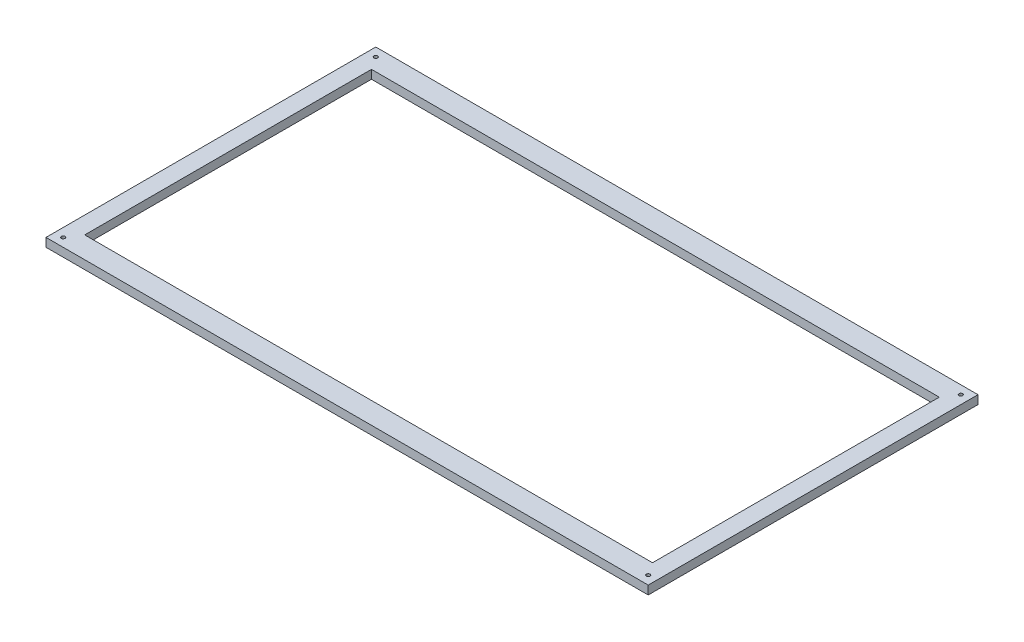
from build123d import *

# Parameters (mm, degrees)
SKETCH1_W           = 2100
SKETCH1_H           = 1150
SKETCH1_W_2         = 1980
SKETCH1_H_2         = 1000
BOSS_EXTRUDE1_DEPTH = 30
SKETCH2_R           = 6.35
CUT_EXTRUDE1_DEPTH  = 1198.507828784


with BuildPart() as part:
    # Sketch1 → Boss-Extrude1 (new body)
    with BuildSketch(Plane(origin=(0, 0, 0), x_dir=(1, 0, 0), z_dir=(0, 1, 0))):
        Rectangle(SKETCH1_W, SKETCH1_H)
        Rectangle(SKETCH1_W_2, SKETCH1_H_2, mode=Mode.SUBTRACT)
    extrude(amount=-BOSS_EXTRUDE1_DEPTH)

    # Sketch2 → Cut-Extrude1 (cut, through all)
    with BuildSketch(Plane(origin=(0, 0, 0), x_dir=(1, 0, 0), z_dir=(0, 1, 0))):
        with Locations(Location((-1020, 545, 0), (0, 0, 270))):
            Circle(SKETCH2_R)
        with Locations(Location((-1020, -545, 0), (0, 0, 270))):
            Circle(SKETCH2_R)
        with Locations(Location((1020, 545, 0), (0, 0, 270))):
            Circle(SKETCH2_R)
        with Locations(Location((1020, -545, 0), (0, 0, 270))):
            Circle(SKETCH2_R)
    extrude(amount=-CUT_EXTRUDE1_DEPTH, mode=Mode.SUBTRACT)


solid = part.part
